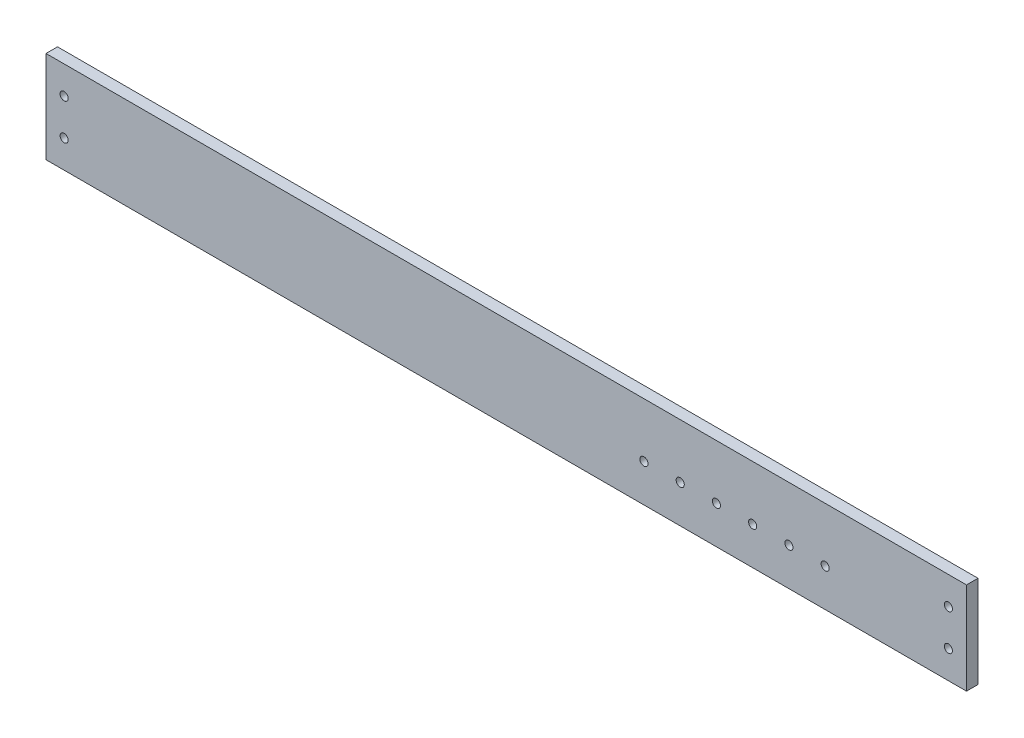
from build123d import *

# Parameters (mm, degrees)
SKETCH1_W           = 254
SKETCH1_H           = 25.4
SKETCH1_R           = 1.125
BOSS_EXTRUDE1_DEPTH = 3.175


with BuildPart() as part:
    # Sketch1 → Boss-Extrude1 (new body)
    with BuildSketch(Plane.XY):
        with Locations((-17.549090909, 54.032727273)):
            Rectangle(SKETCH1_W, SKETCH1_H)
        with Locations((-139.549090909, 59.032727273)):
            Circle(SKETCH1_R, mode=Mode.SUBTRACT)
        with Locations((-139.549090909, 49.032727273)):
            Circle(SKETCH1_R, mode=Mode.SUBTRACT)
        with Locations((104.450909091, 59.032727273)):
            Circle(SKETCH1_R, mode=Mode.SUBTRACT)
        with Locations((104.450909091, 49.032727273)):
            Circle(SKETCH1_R, mode=Mode.SUBTRACT)
        with Locations((20.450909091, 51.732727273)):
            Circle(SKETCH1_R, mode=Mode.SUBTRACT)
        with Locations((30.450909091, 51.732727273)):
            Circle(SKETCH1_R, mode=Mode.SUBTRACT)
        with Locations((40.450909091, 51.732727273)):
            Circle(SKETCH1_R, mode=Mode.SUBTRACT)
        with Locations((50.450909091, 51.732727273)):
            Circle(SKETCH1_R, mode=Mode.SUBTRACT)
        with Locations((60.450909091, 51.732727273)):
            Circle(SKETCH1_R, mode=Mode.SUBTRACT)
        with Locations((70.450909091, 51.732727273)):
            Circle(SKETCH1_R, mode=Mode.SUBTRACT)
    extrude(amount=BOSS_EXTRUDE1_DEPTH)


solid = part.part
